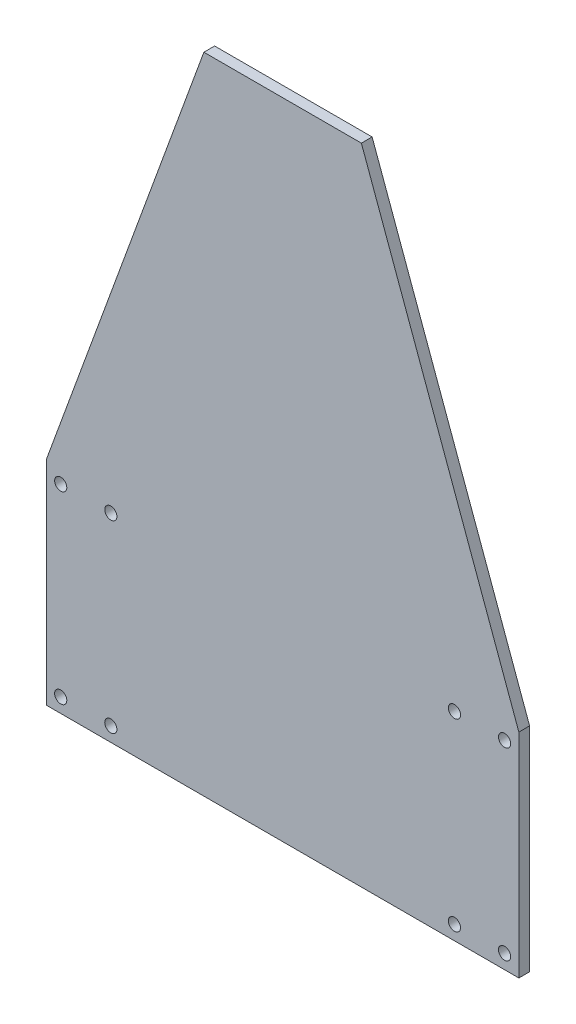
from build123d import *

# Parameters (mm, degrees)
BOSS_EXTRUDE1_DEPTH  = 3
M3_CLEARANCE_HOLE1_D = 3.4


with BuildPart() as part:
    # Sketch1 → Boss-Extrude1 (new body)
    with BuildSketch(Plane.XY):
        Polygon((0, 180), (22, 180), (66, 59.5), (66, 0), (0, 0), align=None)
    boss_extrude1 = extrude(amount=BOSS_EXTRUDE1_DEPTH)

    # M3 Clearance Hole1 (through all)
    with Locations(Plane.XY.offset(3)):
        with Locations((48, 55.5), (62, 55.5), (48, 4), (62, 4)):
            m3_clearance_hole1 = Hole(M3_CLEARANCE_HOLE1_D / 2)

    # Mirror1: Boss-Extrude1, M3 Clearance Hole1 across plane
    add(boss_extrude1.mirror(Plane(origin=(0, 180, 3), x_dir=(0, 0, 1), z_dir=(1, 0, 0))))
    add(m3_clearance_hole1.mirror(Plane(origin=(0, 180, 3), x_dir=(0, 0, 1), z_dir=(1, 0, 0))), mode=Mode.SUBTRACT)


solid = part.part
